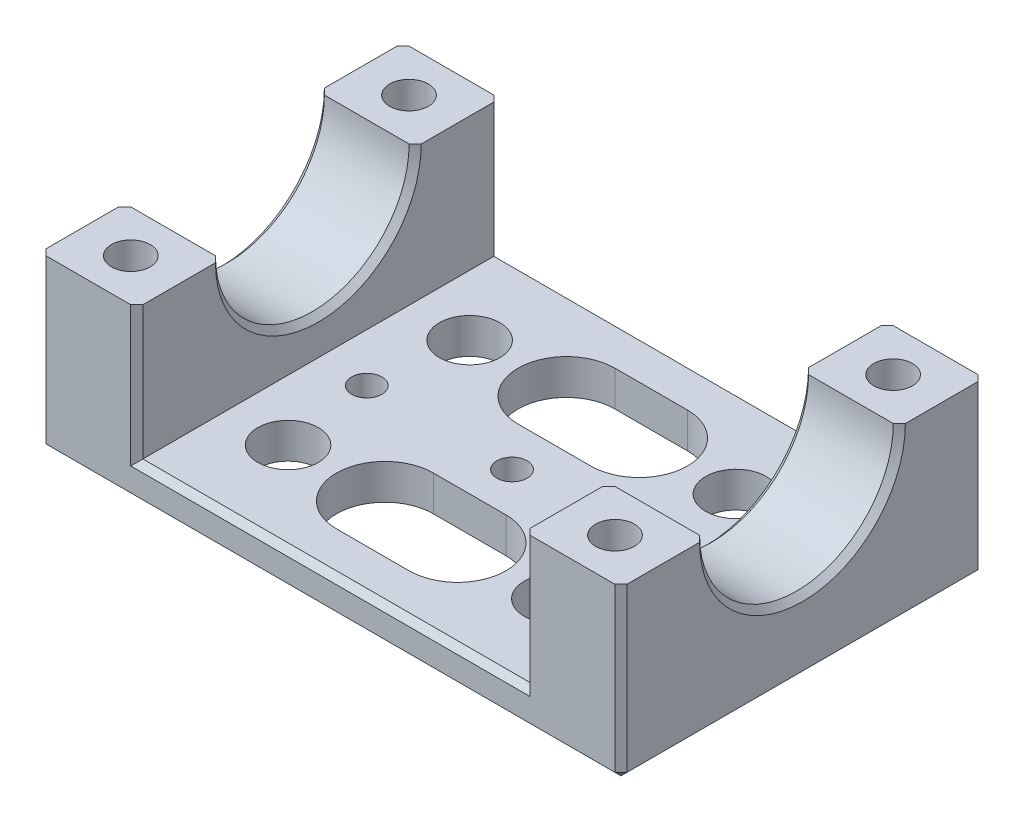
from build123d import *
from build123d.topology import SkipClean

# Parameters (mm, degrees)
SKETCH2_W                = 32
SKETCH2_H                = 30
BOSS_EXTRUDE1_DEPTH      = 2.922658801
BOSS_EXTRUDE2_DEPTH      = 25
BOSS_EXTRUDE2_DEPTH_BACK = 2.922659
SKETCH3_W                = 8
SKETCH3_H                = 30
CUT_EXTRUDE1_DEPTH       = 58.521082001
CUT_EXTRUDE1_DEPTH_BACK  = 58.521082001
SKETCH4_R                = 8
M3X0_5_TAPPED_HOLE1_D    = 2.5
SKETCH7_R                = 2.5
CUT_EXTRUDE2_DEPTH       = 38.762415177
SKETCH8_W                = 30
SKETCH8_H                = 18.9613294
CUT_EXTRUDE3_DEPTH       = 58.521082001
M3_CLEARANCE_HOLE1_D     = 3.2
CHAMFER1_SIZE            = 0.5
SKETCH13_R               = 3
CUT_EXTRUDE4_DEPTH       = 4


with BuildPart() as part:
    # Sketch2 → Boss-Extrude1 (new body)
    with BuildSketch(Plane(origin=(0, 0, 0), x_dir=(1, 0, 0), z_dir=(0, 1, 0))):
        Rectangle(SKETCH2_W, SKETCH2_H)
    extrude(amount=BOSS_EXTRUDE1_DEPTH)

    # Sketch3 → Boss-Extrude2 (add, two sides: drawn at the far end of the back side and taken through both)
    with BuildSketch(Plane(origin=(0, 2.922658801, 0), x_dir=(1, 0, 0), z_dir=(0, 1, 0)).offset(-BOSS_EXTRUDE2_DEPTH_BACK)):
        with Locations((-20, 0)):
            Rectangle(SKETCH3_W, SKETCH3_H)
        with Locations((20, 0)):
            Rectangle(SKETCH3_W, SKETCH3_H)
    extrude(amount=BOSS_EXTRUDE2_DEPTH + BOSS_EXTRUDE2_DEPTH_BACK)

    # Sketch4 → Cut-Extrude1 (cut, two sides: drawn at the far end of the back side and taken through both)
    with BuildSketch(Plane(origin=(24, 0, 0), x_dir=(0, 0, -1), z_dir=(1, 0, 0)).offset(-CUT_EXTRUDE1_DEPTH_BACK)):
        with Locations((0, 13.961329401)):
            Circle(SKETCH4_R)
    extrude(amount=CUT_EXTRUDE1_DEPTH + CUT_EXTRUDE1_DEPTH_BACK, mode=Mode.SUBTRACT)

    # M3x0.5 Tapped Hole1 (through all)
    with Locations(Plane(origin=(0, 2.922658801, 0), x_dir=(1, 0, 0), z_dir=(0, 1, 0))):
        with Locations((12, 0), (0, 0), (-12, 0)):
            Hole(M3X0_5_TAPPED_HOLE1_D / 2)

    # Sketch7 → Cut-Extrude2 (cut, through all)
    with BuildSketch(Plane(origin=(0, 2.922658801, 0), x_dir=(1, 0, 0), z_dir=(0, 1, 0))):
        with Locations(Location((-11, 7.5, 0), (0, 0, 270))):
            Circle(SKETCH7_R)
        with Locations(Location((-11, -7.5, 0), (0, 0, 270))):
            Circle(SKETCH7_R)
        with Locations(Location((11, -7.5, 0), (0, 0, 270))):
            Circle(SKETCH7_R)
        with Locations(Location((11, 7.5, 0), (0, 0, 270))):
            Circle(SKETCH7_R)
        with BuildLine():
            Line((-3, 11.5), (3, 11.5))
            ThreePointArc((3, 11.5), (7, 7.5), (3, 3.5))
            Line((3, 3.5), (-3, 3.5))
            ThreePointArc((-3, 3.5), (-7, 7.5), (-3, 11.5))
        make_face()
        with BuildLine():
            Line((-3, -3.5), (3, -3.5))
            ThreePointArc((3, -3.5), (7, -7.5), (3, -11.5))
            Line((3, -11.5), (-3, -11.5))
            ThreePointArc((-3, -11.5), (-7, -7.5), (-3, -3.5))
        make_face()
    extrude(amount=-CUT_EXTRUDE2_DEPTH, mode=Mode.SUBTRACT)

    # Sketch8 → Cut-Extrude3 (cut, through all)
    with BuildSketch(Plane(origin=(24, 0, 0), x_dir=(0, 0, -1), z_dir=(1, 0, 0))):
        with Locations((0, 23.441994101)):
            Rectangle(SKETCH8_W, SKETCH8_H)
    extrude(amount=-CUT_EXTRUDE3_DEPTH, mode=Mode.SUBTRACT)

    # M3 Clearance Hole1 (through all)
    with Locations(Plane(origin=(0, 0, 0), x_dir=(-1, 0, 0), z_dir=(0, -1, 0))):
        with Locations((-20, 11.49), (20, -11.49), (-20, -11.49), (20, 11.49)):
            Hole(M3_CLEARANCE_HOLE1_D / 2)

    # Chamfer1
    chamfer1_edges = [part.edges().sort_by_distance(p)[0] for p in [
        (-16, 5.961329401, 0),
        (-24, 5.961329401, 0),
        (16, 5.961329401, 0),
        (24, 5.961329401, 0),
        (-16, 8.441994101, -15),
        (-16, 8.441994101, 15),
        (-24, 6.980664601, 15),
        (-24, 6.980664601, -15),
        (-24, -1.99e-07, 0),
        (0, 2.922658801, -15),
        (16, 8.441994101, 15),
        (16, 8.441994101, -15),
        (24, 6.980664601, -15),
        (24, 6.980664601, 15),
        (24, -1.99e-07, 0),
        (0, 0, -15),
        (0, 0, 15),
        (0, 2.922658801, 15),
    ]]
    chamfer(chamfer1_edges, length=CHAMFER1_SIZE)

    # Sketch13 → Cut-Extrude4 (cut)
    with SkipClean():  # the faces are left unmerged after this step: merging them gives an invalid solid
        with BuildSketch(Plane.XZ):
            with Locations(Location((20, -11.49, 0), (0, 0, 270))):
                Circle(SKETCH13_R)
            with Locations(Location((-20, -11.49, 0), (0, 0, 270))):
                Circle(SKETCH13_R)
            with Locations(Location((-20, 11.49, 0), (0, 0, 270))):
                Circle(SKETCH13_R)
            with Locations(Location((20, 11.49, 0), (0, 0, 270))):
                Circle(SKETCH13_R)
        extrude(amount=-CUT_EXTRUDE4_DEPTH, mode=Mode.SUBTRACT)


solid = part.part
